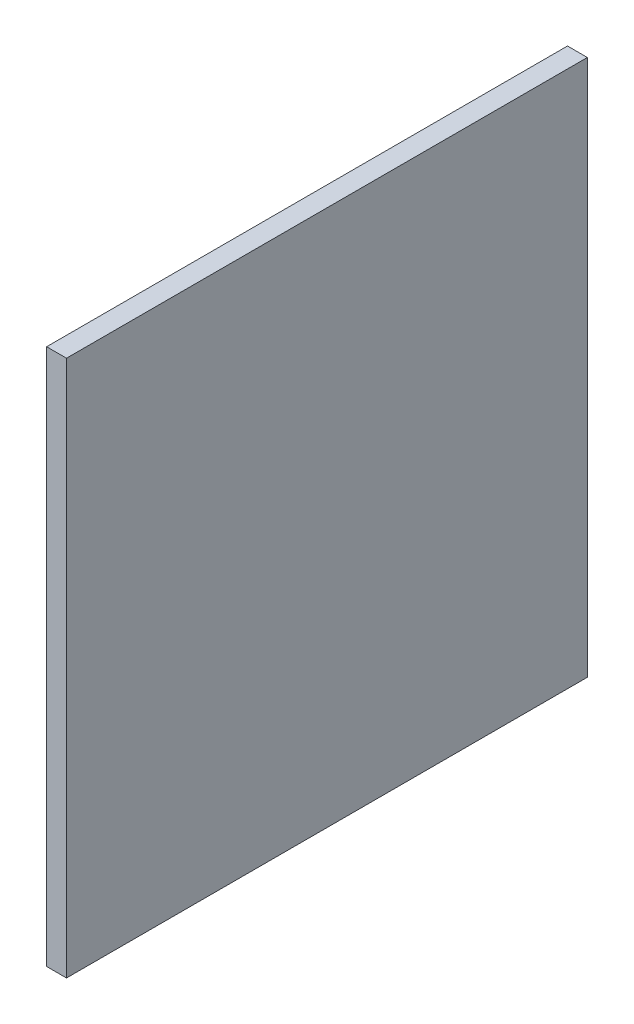
from build123d import *

# Parameters (mm, degrees)
SKETCH1_W           = 66.548
SKETCH1_H           = 68.58
BOSS_EXTRUDE1_DEPTH = 2.54
SKETCH2_W           = 0.427403846
SKETCH2_H           = 4.7625
BOSS_EXTRUDE2_DEPTH = 2.54


with BuildPart() as part:
    # Sketch1 → Boss-Extrude1 (new body)
    with BuildSketch(Plane(origin=(0, 0, 0), x_dir=(0, 0, -1), z_dir=(1, 0, 0))):
        Rectangle(SKETCH1_W, SKETCH1_H)
    extrude(amount=BOSS_EXTRUDE1_DEPTH)

    # Sketch2 → Boss-Extrude2 (add)
    # profile 1 of 15: a face of its own
    with BuildSketch(Plane.ZY):
        with Locations((-24.541075551, 0.623255141)):
            Rectangle(SKETCH2_W, SKETCH2_H)
    # profile 2 of 15: a face of its own
    with BuildSketch(Plane.ZY):
        with BuildLine():
            Line((-23.228335167, 1.722293602), (-22.800931321, 1.722293602))
            Line((-22.800931321, 1.722293602), (-22.800931321, 1.094544203))
            add(Edge.make_bspline(
                [(-22.800931321, 1.094544203), (-22.755296181, 1.151480194), (-22.666739602, 1.26196647), (-22.519259491, 1.407182681), (-22.363397969, 1.526851005), (-22.200109529, 1.622242239), (-22.029172505, 1.694151398), (-21.851628859, 1.746084326), (-21.666415634, 1.777224039), (-21.540461882, 1.781292888), (-21.476742619, 1.783351295)],
                knots=[0, 0, 0, 0, 1.12780773, 2.188550248, 3.19190651, 4.159438251, 5.104880172, 6.052711206, 7.014878035, 8, 8, 8, 8], degree=3))
            add(Edge.make_bspline(
                [(-21.476742619, 1.783351295), (-21.412339149, 1.780976582), (-21.286286023, 1.776328697), (-21.102755518, 1.7395667), (-20.931341722, 1.676776192), (-20.772655826, 1.590762625), (-20.629607725, 1.483801673), (-20.503979981, 1.359190477), (-20.400071419, 1.215858164), (-20.330406436, 1.082884869), (-20.284515465, 0.964926189), (-20.25562432, 0.863897575), (-20.231089306, 0.751341805), (-20.209818963, 0.627599007), (-20.195426536, 0.491802184), (-20.184075061, 0.344508003), (-20.175939766, 0.185764176), (-20.175616995, 0.075972729), (-20.175450551, 0.019356403)],
                knots=[0, 0, 0, 0, 1.235846778, 2.418850247, 3.575807741, 4.728682307, 5.871620074, 6.994088408, 8.11269785, 9.256955736, 9.865816715, 10.540099792, 11.271859618, 12.076849838, 12.949306005, 13.892391288, 14.913166135, 16, 16, 16, 16], degree=3))
            Line((-20.175450551, 0.019356403), (-20.175450551, -1.757994859))
            Line((-20.175450551, -1.757994859), (-20.602854398, -1.757994859))
            Line((-20.602854398, -1.757994859), (-20.602854398, -0.120885484))
            add(Edge.make_bspline(
                [(-20.602854398, -0.120885484), (-20.603117298, -0.073502086), (-20.603620183, 0.017134291), (-20.605206295, 0.146904283), (-20.609029639, 0.264587806), (-20.614402165, 0.369903509), (-20.622265774, 0.462750266), (-20.630460855, 0.543317174), (-20.640482484, 0.611501945), (-20.649412734, 0.652548003), (-20.653417799, 0.670956463)],
                knots=[0, 0, 0, 0, 1.430800155, 2.736877192, 3.918605307, 4.986035426, 5.920637409, 6.731861385, 7.431261377, 8, 8, 8, 8], degree=3))
            add(Edge.make_bspline(
                [(-20.653417799, 0.670956463), (-20.667876111, 0.72499204), (-20.69570389, 0.828993806), (-20.764466203, 0.970064979), (-20.85129907, 1.090077513), (-20.957295786, 1.188289409), (-21.081432493, 1.264721869), (-21.223364712, 1.317754286), (-21.381722791, 1.350923424), (-21.493103219, 1.354226057), (-21.551156681, 1.355947448)],
                knots=[0, 0, 0, 0, 1.084156227, 2.086665306, 3.027808233, 3.945421172, 4.874247719, 5.839848303, 6.874090471, 8, 8, 8, 8], degree=3))
            add(Edge.make_bspline(
                [(-21.551156681, 1.355947448), (-21.585538779, 1.355299742), (-21.653580063, 1.354017948), (-21.754476989, 1.341157432), (-21.852345239, 1.32012289), (-21.948167023, 1.291726637), (-22.040025843, 1.252725478), (-22.130872967, 1.208462299), (-22.217287529, 1.153287768), (-22.301112151, 1.091796244), (-22.379098507, 1.023652751), (-22.451663139, 0.951746471), (-22.516348802, 0.875171453), (-22.574952964, 0.795161525), (-22.625541958, 0.710617845), (-22.669701339, 0.622356057), (-22.707169552, 0.53025999), (-22.725787787, 0.466340353), (-22.735103496, 0.434357905)],
                knots=[0, 0, 0, 0, 1.023777757, 2.026029729, 3.023749952, 4.003683103, 4.997618607, 5.993177895, 7.010360494, 8.046726602, 9.087585522, 10.09234134, 11.086953743, 12.070360549, 13.043493632, 14.017870808, 15.008233677, 16, 16, 16, 16], degree=3))
            add(Edge.make_bspline(
                [(-22.735103496, 0.434357905), (-22.740464232, 0.410878504), (-22.752134274, 0.359765076), (-22.764738815, 0.275884633), (-22.776179123, 0.178852132), (-22.785754413, 0.0687808), (-22.791612855, -0.054714737), (-22.798000588, -0.191107073), (-22.800326132, -0.34094007), (-22.800723942, -0.44525473), (-22.800931321, -0.499633982)],
                knots=[0, 0, 0, 0, 0.615963638, 1.340920617, 2.168419149, 3.115676021, 4.16674242, 5.331190069, 6.6087489, 8, 8, 8, 8], degree=3))
            Line((-22.800931321, -0.499633982), (-22.800931321, -1.757994859))
            Line((-22.800931321, -1.757994859), (-23.228335167, -1.757994859))
            Line((-23.228335167, -1.757994859), (-23.228335167, 1.722293602))
        make_face()
    # profile 3 of 15: a face of its own
    with BuildSketch(Plane.ZY):
        with BuildLine():
            Line((-17.549969782, 1.288211571), (-17.839993821, 0.989601295))
            add(Edge.make_bspline(
                [(-17.839993821, 0.989601295), (-17.865018041, 1.018602397), (-17.913261793, 1.074513109), (-17.989776773, 1.14926676), (-18.066008891, 1.212045952), (-18.140914598, 1.265048847), (-18.216377457, 1.305120722), (-18.291511906, 1.334369088), (-18.366395739, 1.352469045), (-18.416451023, 1.354801906), (-18.441030479, 1.355947448)],
                knots=[0, 0, 0, 0, 1.26578478, 2.440284043, 3.530471711, 4.527705817, 5.468200915, 6.346673037, 7.188140097, 8, 8, 8, 8], degree=3))
            add(Edge.make_bspline(
                [(-18.441030479, 1.355947448), (-18.471155863, 1.354484853), (-18.530438356, 1.351606673), (-18.615382058, 1.322877327), (-18.694236302, 1.278778294), (-18.762485621, 1.216228185), (-18.820299214, 1.144431091), (-18.862499973, 1.064153949), (-18.888307258, 0.97781929), (-18.891579411, 0.917907233), (-18.893239013, 0.887520465)],
                knots=[0, 0, 0, 0, 0.99966794, 1.967205029, 2.953328237, 3.988086729, 5.028030931, 6.008226631, 6.989793394, 8, 8, 8, 8], degree=3))
            add(Edge.make_bspline(
                [(-18.893239013, 0.887520465), (-18.891727515, 0.860017648), (-18.888708779, 0.805089544), (-18.865240977, 0.724061683), (-18.8278675, 0.645062642), (-18.7929377, 0.596671687), (-18.774939734, 0.571737713)],
                knots=[0, 0, 0, 0, 0.960159726, 1.917612774, 2.927026955, 4, 4, 4, 4], degree=3))
            add(Edge.make_bspline(
                [(-18.774939734, 0.571737713), (-18.764103694, 0.558423689), (-18.741040549, 0.530086468), (-18.697758249, 0.490756582), (-18.648741914, 0.447292304), (-18.589795856, 0.403835394), (-18.523459636, 0.358072225), (-18.448294753, 0.311805037), (-18.366686587, 0.261507016), (-18.308261181, 0.229605838), (-18.277891958, 0.213023771)],
                knots=[0, 0, 0, 0, 0.66740084, 1.420478572, 2.27185888, 3.217733974, 4.268547843, 5.408967954, 6.65319498, 8, 8, 8, 8], degree=3))
            add(Edge.make_bspline(
                [(-18.277891958, 0.213023771), (-18.240862055, 0.192279814), (-18.169332475, 0.152209319), (-18.067696959, 0.090011473), (-17.975458164, 0.028192285), (-17.89183456, -0.032587113), (-17.81843517, -0.094027265), (-17.753033046, -0.153773177), (-17.697259485, -0.213630058), (-17.666025749, -0.255449044), (-17.651096585, -0.275437768)],
                knots=[0, 0, 0, 0, 1.27191281, 2.456916733, 3.569705269, 4.599008579, 5.553216877, 6.436649441, 7.252746552, 8, 8, 8, 8], degree=3))
            add(Edge.make_bspline(
                [(-17.651096585, -0.275437768), (-17.62631726, -0.315804838), (-17.577001805, -0.396142799), (-17.525215378, -0.528429302), (-17.495197647, -0.668733235), (-17.49103084, -0.764707435), (-17.48891209, -0.813508681)],
                knots=[0, 0, 0, 0, 0.995354457, 1.980940102, 2.973342416, 4, 4, 4, 4], degree=3))
            add(Edge.make_bspline(
                [(-17.48891209, -0.813508681), (-17.48989117, -0.84789277), (-17.491820554, -0.915650372), (-17.505234566, -1.015438122), (-17.528305445, -1.110871217), (-17.559729446, -1.202985158), (-17.602162467, -1.290015), (-17.651893577, -1.374156468), (-17.711594796, -1.453589431), (-17.779754847, -1.528209587), (-17.854383894, -1.596361979), (-17.933994032, -1.656266002), (-18.018683298, -1.706033225), (-18.107846553, -1.747215713), (-18.201686382, -1.779965735), (-18.300217458, -1.80263868), (-18.403126585, -1.816208758), (-18.473107859, -1.818092635), (-18.508766357, -1.819052552)],
                knots=[0, 0, 0, 0, 1.032770009, 2.035186124, 3.017557409, 3.978232242, 4.952395191, 5.920591857, 6.910227898, 7.931268572, 8.952309245, 9.941945286, 10.918353717, 11.897095711, 12.887975737, 13.898235213, 14.929059601, 16, 16, 16, 16], degree=3))
            add(Edge.make_bspline(
                [(-18.508766357, -1.819052552), (-18.556890978, -1.81770177), (-18.652471532, -1.815018976), (-18.793835757, -1.789837514), (-18.931976503, -1.75065521), (-19.065848392, -1.696613171), (-19.192457568, -1.62837238), (-19.308296434, -1.546644623), (-19.413767388, -1.454129662), (-19.473799753, -1.38321888), (-19.503815936, -1.347763489)],
                knots=[0, 0, 0, 0, 1.013940152, 2.01379169, 3.017749504, 4.037548394, 5.051665909, 6.043208538, 7.021604269, 8, 8, 8, 8], degree=3))
            Line((-19.503815936, -1.347763489), (-19.220470083, -1.025302552))
            add(Edge.make_bspline(
                [(-19.220470083, -1.025302552), (-19.193565478, -1.054360285), (-19.141406833, -1.110693094), (-19.057993392, -1.185701572), (-18.97311285, -1.248568302), (-18.887612794, -1.301150948), (-18.800227594, -1.341666765), (-18.711446955, -1.370130994), (-18.621451456, -1.388424699), (-18.561005622, -1.39057229), (-18.530708965, -1.391648705)],
                knots=[0, 0, 0, 0, 1.179806542, 2.287233372, 3.337373186, 4.324005949, 5.273901747, 6.200048787, 7.097828587, 8, 8, 8, 8], degree=3))
            add(Edge.make_bspline(
                [(-18.530708965, -1.391648705), (-18.48945493, -1.389783404), (-18.408851466, -1.386138919), (-18.293403351, -1.353050305), (-18.186806863, -1.301166335), (-18.094246525, -1.227572513), (-18.015458228, -1.141907966), (-17.958405962, -1.045414111), (-17.922651594, -0.940922879), (-17.918452432, -0.868488924), (-17.916315936, -0.831635184)],
                knots=[0, 0, 0, 0, 1.072336372, 2.095165389, 3.102688358, 4.141489647, 5.156069229, 6.117746104, 7.042326257, 8, 8, 8, 8], degree=3))
            add(Edge.make_bspline(
                [(-17.916315936, -0.831635184), (-17.917794072, -0.801278167), (-17.920712454, -0.741342301), (-17.943631335, -0.654596301), (-17.979843823, -0.572314887), (-18.015500863, -0.524159688), (-18.033661188, -0.499633982)],
                knots=[0, 0, 0, 0, 1.013901739, 2.00181326, 2.98231254, 4, 4, 4, 4], degree=3))
            add(Edge.make_bspline(
                [(-18.033661188, -0.499633982), (-18.044577375, -0.487339435), (-18.068356772, -0.460557473), (-18.111974797, -0.421879062), (-18.164201545, -0.380189363), (-18.22562441, -0.336195308), (-18.296367213, -0.290477206), (-18.376716678, -0.243274909), (-18.465572073, -0.192346468), (-18.52839711, -0.158574008), (-18.561237811, -0.14092004)],
                knots=[0, 0, 0, 0, 0.615000592, 1.339693406, 2.178160186, 3.116406724, 4.166410947, 5.330106347, 6.604359322, 8, 8, 8, 8], degree=3))
            add(Edge.make_bspline(
                [(-18.561237811, -0.14092004), (-18.596679846, -0.121136435), (-18.665413263, -0.082769713), (-18.762768684, -0.023012475), (-18.850599191, 0.037766923), (-18.931018187, 0.096159037), (-19.001994413, 0.155242535), (-19.063248257, 0.21508301), (-19.117191347, 0.273267134), (-19.147055504, 0.314493098), (-19.161320443, 0.334185129)],
                knots=[0, 0, 0, 0, 1.262093308, 2.447601706, 3.550203992, 4.582594899, 5.537233252, 6.418365656, 7.244515135, 8, 8, 8, 8], degree=3))
            add(Edge.make_bspline(
                [(-19.161320443, 0.334185129), (-19.185991009, 0.373843983), (-19.235340762, 0.453175552), (-19.283258576, 0.585587308), (-19.316196065, 0.724985761), (-19.319138461, 0.821170373), (-19.320642859, 0.870347989)],
                knots=[0, 0, 0, 0, 0.985009483, 1.970363186, 2.962279964, 4, 4, 4, 4], degree=3))
            add(Edge.make_bspline(
                [(-19.320642859, 0.870347989), (-19.319915972, 0.902495406), (-19.318493351, 0.965412454), (-19.30713948, 1.057857778), (-19.286467902, 1.145689373), (-19.260539597, 1.230226283), (-19.224503794, 1.309830918), (-19.181442759, 1.385564834), (-19.130841299, 1.457323351), (-19.072543821, 1.524002613), (-19.008445136, 1.584567089), (-18.939191895, 1.637360936), (-18.866341625, 1.682409226), (-18.789585882, 1.720189677), (-18.70818731, 1.748766558), (-18.622714877, 1.768438929), (-18.533341592, 1.781576901), (-18.472243988, 1.782751312), (-18.441030479, 1.783351295)],
                knots=[0, 0, 0, 0, 1.087655834, 2.128696564, 3.144119009, 4.137814668, 5.115653402, 6.093965665, 7.082169637, 8.081268856, 9.086088321, 10.061021666, 11.022561449, 11.980240094, 12.950172527, 13.934149372, 14.944599409, 16, 16, 16, 16], degree=3))
            add(Edge.make_bspline(
                [(-18.441030479, 1.783351295), (-18.40402985, 1.781848602), (-18.329334498, 1.778815029), (-18.217273382, 1.754722643), (-18.105377299, 1.715080812), (-17.99335874, 1.660330795), (-17.882038311, 1.589482653), (-17.770436802, 1.503853856), (-17.657214447, 1.404007752), (-17.586516749, 1.327672734), (-17.549969782, 1.288211571)],
                knots=[0, 0, 0, 0, 0.845714091, 1.707292901, 2.609013841, 3.555613372, 4.552488639, 5.621697636, 6.770543573, 8, 8, 8, 8], degree=3))
        make_face()
    # profile 4 of 15: a face of its own
    with BuildSketch(Plane.ZY):
        Polygon((-16.206700551, 3.126620525), (-15.779296705, 3.126620525), (-15.779296705, 1.722293602), (-15.168719782, 1.722293602), (-15.168719782, 1.294889756), (-15.779296705, 1.294889756), (-15.779296705, -1.757994859), (-16.206700551, -1.757994859), (-16.206700551, 1.294889756), (-16.817277474, 1.294889756), (-16.817277474, 1.722293602), (-16.206700551, 1.722293602), align=None)
    # profile 5 of 15: a face of its own
    with BuildSketch(Plane.ZY):
        with BuildLine():
            Line((-14.558142859, 1.722293602), (-14.130739013, 1.722293602))
            Line((-14.130739013, 1.722293602), (-14.130739013, 1.209981403))
            add(Edge.make_bspline(
                [(-14.130739013, 1.209981403), (-14.099185738, 1.257682369), (-14.038840344, 1.348910097), (-13.938538108, 1.469563681), (-13.835799646, 1.569460584), (-13.730133124, 1.649067158), (-13.620761495, 1.708684295), (-13.510085143, 1.752353746), (-13.396362807, 1.77817645), (-13.319942474, 1.781624036), (-13.281655479, 1.783351295)],
                knots=[0, 0, 0, 0, 1.2804753, 2.448899062, 3.506932113, 4.484331642, 5.4025378, 6.288909075, 7.142734305, 8, 8, 8, 8], degree=3))
            add(Edge.make_bspline(
                [(-13.281655479, 1.783351295), (-13.251956085, 1.781731328), (-13.190847651, 1.778398142), (-13.09834277, 1.754979127), (-13.003033644, 1.717589389), (-12.941607753, 1.682428229), (-12.909585167, 1.664097989)],
                knots=[0, 0, 0, 0, 0.901110191, 1.854092781, 2.881294221, 4, 4, 4, 4], degree=3))
            Line((-12.909585167, 1.664097989), (-13.144275672, 1.29393573))
            add(Edge.make_bspline(
                [(-13.144275672, 1.29393573), (-13.164834732, 1.303107306), (-13.203859766, 1.320516714), (-13.260947943, 1.341120663), (-13.313582191, 1.353252677), (-13.347115033, 1.355090618), (-13.362747727, 1.355947448)],
                knots=[0, 0, 0, 0, 1.180555205, 2.24091978, 3.179933427, 4, 4, 4, 4], degree=3))
            add(Edge.make_bspline(
                [(-13.362747727, 1.355947448), (-13.397045529, 1.353661398), (-13.467003102, 1.348998517), (-13.569715939, 1.312342496), (-13.669384458, 1.25311708), (-13.74853947, 1.187433888), (-13.809829107, 1.124095635), (-13.853562771, 1.068784773), (-13.893680366, 1.006765278), (-13.932011987, 0.939097387), (-13.96693648, 0.864625704), (-13.999531941, 0.78409426), (-14.029003465, 0.697409781), (-14.045808619, 0.637017852), (-14.054416898, 0.606082665)],
                knots=[0, 0, 0, 0, 1.125678352, 2.296057538, 3.5422874, 4.923748041, 5.663163013, 6.437101912, 7.23742474, 8.08941207, 8.991984279, 9.93940061, 10.944477711, 12, 12, 12, 12], degree=3))
            add(Edge.make_bspline(
                [(-14.054416898, 0.606082665), (-14.060856333, 0.578491225), (-14.075119193, 0.517378283), (-14.088986964, 0.414850469), (-14.102688701, 0.293714704), (-14.112345171, 0.153633805), (-14.121296007, -0.005042414), (-14.126344368, -0.182555682), (-14.130566856, -0.379088207), (-14.130679886, -0.516485452), (-14.130739013, -0.588358441)],
                knots=[0, 0, 0, 0, 0.566838948, 1.255505196, 2.06880316, 3.007127437, 4.065329342, 5.249902469, 6.561414163, 8, 8, 8, 8], degree=3))
            Line((-14.130739013, -0.588358441), (-14.130739013, -1.757994859))
            Line((-14.130739013, -1.757994859), (-14.558142859, -1.757994859))
            Line((-14.558142859, -1.757994859), (-14.558142859, 1.722293602))
        make_face()
    # profile 6 of 15: a face of its own
    with BuildSketch(Plane.ZY):
        with BuildLine():
            Line((-12.543239013, 1.722293602), (-12.115835167, 1.722293602))
            Line((-12.115835167, 1.722293602), (-12.115835167, 0.108080862))
            add(Edge.make_bspline(
                [(-12.115835167, 0.108080862), (-12.115642075, 0.06069705), (-12.115272699, -0.029945964), (-12.112767704, -0.160377486), (-12.106875684, -0.279326655), (-12.099509015, -0.386862187), (-12.090035537, -0.482965887), (-12.07876425, -0.567302084), (-12.066166184, -0.64082717), (-12.05383442, -0.685109379), (-12.048099289, -0.705703693)],
                knots=[0, 0, 0, 0, 1.388932606, 2.656963016, 3.823490214, 4.879454478, 5.816252168, 6.653371382, 7.373723809, 8, 8, 8, 8], degree=3))
            add(Edge.make_bspline(
                [(-12.048099289, -0.705703693), (-12.038898881, -0.731588386), (-12.020689338, -0.782819634), (-11.987660062, -0.85682753), (-11.946800076, -0.925373897), (-11.902087238, -0.991101938), (-11.850516973, -1.052064642), (-11.792741764, -1.108159059), (-11.730695592, -1.161504626), (-11.638500363, -1.224621075), (-11.512417577, -1.292269435), (-11.346882934, -1.350638388), (-11.16739897, -1.385521415), (-11.043349834, -1.389568526), (-10.979589674, -1.391648705)],
                knots=[0, 0, 0, 0, 0.725840625, 1.436591201, 2.137033971, 2.831655856, 3.53531722, 4.242432219, 4.957935707, 5.694543706, 7.190802206, 8.724350549, 10.316345118, 12, 12, 12, 12], degree=3))
            add(Edge.make_bspline(
                [(-10.979589674, -1.391648705), (-10.915835437, -1.389524292), (-10.792482784, -1.385413946), (-10.614970843, -1.35169063), (-10.45270374, -1.295349318), (-10.307310124, -1.216689947), (-10.179449463, -1.120430211), (-10.072899522, -1.00747894), (-9.984987508, -0.881409595), (-9.946602546, -0.787351202), (-9.927298508, -0.740048645)],
                knots=[0, 0, 0, 0, 1.157059328, 2.238695713, 3.266970494, 4.264342957, 5.228770407, 6.160125903, 7.074715775, 8, 8, 8, 8], degree=3))
            add(Edge.make_bspline(
                [(-9.927298508, -0.740048645), (-9.921591359, -0.721044503), (-9.908974247, -0.679030986), (-9.895418333, -0.607757114), (-9.883206655, -0.522760635), (-9.872779262, -0.423485358), (-9.865342737, -0.310190718), (-9.861334037, -0.182912122), (-9.856805205, -0.042049128), (-9.856736467, 0.056558787), (-9.856700551, 0.108080862)],
                knots=[0, 0, 0, 0, 0.557542046, 1.232589297, 2.036731608, 2.971723315, 4.038036528, 5.22795436, 6.551621927, 8, 8, 8, 8], degree=3))
            Line((-9.856700551, 0.108080862), (-9.856700551, 1.722293602))
            Line((-9.856700551, 1.722293602), (-9.429296705, 1.722293602))
            Line((-9.429296705, 1.722293602), (-9.429296705, 0.027942641))
            add(Edge.make_bspline(
                [(-9.429296705, 0.027942641), (-9.429897726, -0.029625332), (-9.431063788, -0.141315073), (-9.438557709, -0.303626668), (-9.451415931, -0.454886723), (-9.470932228, -0.595175304), (-9.493881592, -0.724385306), (-9.523485664, -0.842682331), (-9.558834623, -0.949701902), (-9.598711056, -1.047321963), (-9.645821525, -1.135832201), (-9.695932578, -1.219837009), (-9.753796643, -1.297252038), (-9.81471614, -1.371930946), (-9.882481965, -1.440159239), (-9.955824273, -1.503502497), (-10.033710769, -1.562929016), (-10.117869856, -1.616121078), (-10.207072928, -1.66404087), (-10.301430105, -1.706517034), (-10.402097106, -1.740130183), (-10.507775126, -1.769127911), (-10.618981922, -1.791871527), (-10.735610285, -1.807909677), (-10.857620931, -1.817741288), (-10.940773446, -1.818608124), (-10.98340578, -1.819052552)],
                knots=[0, 0, 0, 0, 1.493040784, 2.896703357, 4.213163133, 5.428574705, 6.569057535, 7.615249723, 8.588095153, 9.490268104, 10.346124644, 11.18633936, 12.024365274, 12.850166724, 13.684164916, 14.514361689, 15.362232829, 16.222528818, 17.093394965, 17.986930858, 18.902426812, 19.842810585, 20.827885679, 21.843828298, 22.894529745, 24, 24, 24, 24], degree=3))
            add(Edge.make_bspline(
                [(-10.98340578, -1.819052552), (-11.025719251, -1.818590307), (-11.10886916, -1.817681954), (-11.230886103, -1.807963994), (-11.3478376, -1.791896448), (-11.459307856, -1.768961313), (-11.565408733, -1.74033315), (-11.666570002, -1.706310482), (-11.761607136, -1.664018826), (-11.851661934, -1.616424364), (-11.93602947, -1.562587329), (-12.015098642, -1.503575818), (-12.088763431, -1.439477925), (-12.157040084, -1.370561342), (-12.218970241, -1.295971154), (-12.275325641, -1.216307373), (-12.326973872, -1.132359346), (-12.373718204, -1.042466257), (-12.413875272, -0.943716486), (-12.449329017, -0.834455079), (-12.478326707, -0.713484155), (-12.501924852, -0.580907138), (-12.520908776, -0.437358528), (-12.534088848, -0.282007934), (-12.541458246, -0.115233767), (-12.542632626, -4.9452e-05), (-12.543239013, 0.059425513)],
                knots=[0, 0, 0, 0, 1.083640291, 2.129454052, 3.13281866, 4.105697902, 5.042300162, 5.946461698, 6.836384745, 7.703652036, 8.553297018, 9.397182691, 10.228592656, 11.052265423, 11.879314572, 12.708807002, 13.549817954, 14.402308542, 15.300838682, 16.27712199, 17.341985831, 18.484375296, 19.725102775, 21.0496083, 22.476576903, 24, 24, 24, 24], degree=3))
            Line((-12.543239013, 0.059425513), (-12.543239013, 1.722293602))
        make_face()
    # profile 7 of 15: a face of its own
    with BuildSketch(Plane.ZY):
        with BuildLine():
            Line((-8.452373628, 1.722293602), (-8.024969782, 1.722293602))
            Line((-8.024969782, 1.722293602), (-8.024969782, 1.117440838))
            add(Edge.make_bspline(
                [(-8.024969782, 1.117440838), (-7.986483407, 1.170355753), (-7.912739824, 1.271745804), (-7.791819061, 1.405354726), (-7.671020136, 1.518740536), (-7.584025071, 1.578262087), (-7.542232402, 1.606856403)],
                knots=[0, 0, 0, 0, 1.134379233, 2.173579362, 3.122582517, 4, 4, 4, 4], degree=3))
            add(Edge.make_bspline(
                [(-7.542232402, 1.606856403), (-7.485266558, 1.634077989), (-7.372330131, 1.688045569), (-7.193506114, 1.742791947), (-7.01052451, 1.776435746), (-6.886960476, 1.781036829), (-6.824804518, 1.783351295)],
                knots=[0, 0, 0, 0, 1.014936303, 2.012140481, 3.000054389, 4, 4, 4, 4], degree=3))
            add(Edge.make_bspline(
                [(-6.824804518, 1.783351295), (-6.782767976, 1.781928953), (-6.69957992, 1.779114214), (-6.576320855, 1.760798952), (-6.456770387, 1.729140338), (-6.341634868, 1.685043229), (-6.233157801, 1.631639702), (-6.133704285, 1.568979206), (-6.044408488, 1.498634257), (-5.965315539, 1.41742828), (-5.89419233, 1.32308098), (-5.828770756, 1.213047842), (-5.768320735, 1.084858131), (-5.734818169, 0.991830802), (-5.717179818, 0.942853999)],
                knots=[0, 0, 0, 0, 1.009824226, 1.998387844, 2.986035974, 3.974953746, 4.955485308, 5.885931332, 6.793869504, 7.679848016, 8.601185859, 9.625726857, 10.749998409, 12, 12, 12, 12], degree=3))
            add(Edge.make_bspline(
                [(-5.717179818, 0.942853999), (-5.698522723, 0.976496869), (-5.661808179, 1.042701314), (-5.600160151, 1.136397735), (-5.535570042, 1.224036977), (-5.467487393, 1.305688576), (-5.396152509, 1.380949316), (-5.321229675, 1.450068025), (-5.243145383, 1.51334153), (-5.134570942, 1.587259829), (-4.993311644, 1.665774651), (-4.815210317, 1.73384907), (-4.629948833, 1.775917087), (-4.504194751, 1.780856851), (-4.440692438, 1.783351295)],
                knots=[0, 0, 0, 0, 0.86119277, 1.694706429, 2.50939023, 3.298075842, 4.073795165, 4.829715201, 5.57930267, 6.321991688, 7.768977793, 9.186738141, 10.579381044, 12, 12, 12, 12], degree=3))
            add(Edge.make_bspline(
                [(-4.440692438, 1.783351295), (-4.382343019, 1.781150719), (-4.268147541, 1.776843979), (-4.10189919, 1.743025503), (-3.946856948, 1.684953419), (-3.803332784, 1.605714078), (-3.673847466, 1.506138117), (-3.561294202, 1.387662306), (-3.466356672, 1.251124666), (-3.404337166, 1.122684138), (-3.362270324, 1.00928856), (-3.336333431, 0.912669285), (-3.313419417, 0.806327351), (-3.294394937, 0.690135602), (-3.280490407, 0.563683596), (-3.270188826, 0.427178268), (-3.263216426, 0.280513527), (-3.262723749, 0.179323329), (-3.262469782, 0.127161391)],
                knots=[0, 0, 0, 0, 1.209669288, 2.367440248, 3.500751976, 4.631527125, 5.755587489, 6.87532382, 8.007944318, 9.190864318, 9.82315674, 10.514484317, 11.263564316, 12.079023757, 12.955305781, 13.901327259, 14.918167583, 16, 16, 16, 16], degree=3))
            Line((-3.262469782, 0.127161391), (-3.262469782, -1.757994859))
            Line((-3.262469782, -1.757994859), (-3.689873628, -1.757994859))
            Line((-3.689873628, -1.757994859), (-3.689873628, 0.129069444))
            add(Edge.make_bspline(
                [(-3.689873628, 0.129069444), (-3.689979605, 0.173592796), (-3.690183275, 0.259159908), (-3.693848538, 0.381967708), (-3.700754591, 0.493911437), (-3.708829938, 0.594838457), (-3.720047408, 0.68498413), (-3.734533479, 0.764167385), (-3.749879179, 0.833011107), (-3.77537351, 0.909328193), (-3.816124034, 0.993515872), (-3.878196391, 1.084307595), (-3.956396785, 1.16333897), (-4.046693998, 1.231943893), (-4.149493846, 1.287724527), (-4.262793345, 1.327560811), (-4.385889072, 1.352220871), (-4.471100795, 1.354678342), (-4.515106501, 1.355947448)],
                knots=[0, 0, 0, 0, 1.253487763, 2.409012846, 3.458416907, 4.410876679, 5.259312806, 6.014470957, 6.676830364, 7.243083969, 8.276244668, 9.299465089, 10.325150304, 11.392391894, 12.482080715, 13.603491619, 14.762376348, 16, 16, 16, 16], degree=3))
            add(Edge.make_bspline(
                [(-4.515106501, 1.355947448), (-4.569085975, 1.354020463), (-4.675769936, 1.350212007), (-4.831497544, 1.31133113), (-4.981136677, 1.252711217), (-5.120222269, 1.167758481), (-5.248167227, 1.065965671), (-5.358248438, 0.944930686), (-5.449187948, 0.808002107), (-5.510765679, 0.681256058), (-5.54966755, 0.567405851), (-5.575353639, 0.467941212), (-5.595333539, 0.354890936), (-5.614071295, 0.229014672), (-5.626301025, 0.089445962), (-5.637415846, -0.063169577), (-5.642614948, -0.229290964), (-5.643342194, -0.344443708), (-5.643719782, -0.404231338)],
                knots=[0, 0, 0, 0, 1.090531906, 2.155305635, 3.229839962, 4.33261226, 5.44038871, 6.529323825, 7.629011124, 8.757537029, 9.370236727, 10.061839251, 10.834451254, 11.692844982, 12.636905849, 13.66920014, 14.789842145, 16, 16, 16, 16], degree=3))
            Line((-5.643719782, -0.404231338), (-5.643719782, -1.757994859))
            Line((-5.643719782, -1.757994859), (-6.071123628, -1.757994859))
            Line((-6.071123628, -1.757994859), (-6.071123628, 0.011724191))
            add(Edge.make_bspline(
                [(-6.071123628, 0.011724191), (-6.071231711, 0.061653314), (-6.071439652, 0.157711929), (-6.075081355, 0.295462037), (-6.082002794, 0.420758078), (-6.09000454, 0.533454427), (-6.101516426, 0.633346271), (-6.114592566, 0.720969138), (-6.130034783, 0.79610336), (-6.155602447, 0.878512823), (-6.194674634, 0.969300936), (-6.257523662, 1.06610354), (-6.33591112, 1.150832629), (-6.427855776, 1.223166498), (-6.531277794, 1.282958299), (-6.645555207, 1.326038176), (-6.769659035, 1.35110837), (-6.855217627, 1.354304003), (-6.89921858, 1.355947448)],
                knots=[0, 0, 0, 0, 1.320475261, 2.540461679, 3.643808994, 4.639130445, 5.527981419, 6.302341397, 6.981980563, 7.553956391, 8.582137848, 9.585246428, 10.591171744, 11.620968678, 12.668337649, 13.738356861, 14.836885341, 16, 16, 16, 16], degree=3))
            add(Edge.make_bspline(
                [(-6.89921858, 1.355947448), (-6.950947782, 1.35386493), (-7.054042245, 1.349714544), (-7.205492425, 1.312357121), (-7.35174973, 1.253840862), (-7.490480945, 1.172660894), (-7.617944697, 1.072105362), (-7.729534518, 0.953839022), (-7.823345597, 0.81933373), (-7.885573531, 0.693924155), (-7.925712526, 0.582926235), (-7.952376178, 0.48855941), (-7.975290098, 0.383784072), (-7.992318106, 0.268276967), (-8.0087561, 0.142790407), (-8.016689485, 0.006699262), (-8.02440686, -0.139879722), (-8.024777539, -0.241079506), (-8.024969782, -0.29356427)],
                knots=[0, 0, 0, 0, 1.098833095, 2.189935336, 3.297829714, 4.440610912, 5.596351641, 6.740013378, 7.886572111, 9.072425424, 9.705826452, 10.395263256, 11.156850408, 11.985370555, 12.878090359, 13.847760091, 14.883794034, 16, 16, 16, 16], degree=3))
            Line((-8.024969782, -0.29356427), (-8.024969782, -1.757994859))
            Line((-8.024969782, -1.757994859), (-8.452373628, -1.757994859))
            Line((-8.452373628, -1.757994859), (-8.452373628, 1.722293602))
        make_face()
    # profile 8 of 15: a face of its own
    with BuildSketch(Plane.ZY):
        with BuildLine():
            Line((0.570808463, -0.658956398), (0.950510987, -0.858347924))
            add(Edge.make_bspline(
                [(0.950510987, -0.858347924), (0.920253334, -0.912019028), (0.861383924, -1.016441743), (0.760145764, -1.159904382), (0.654020836, -1.288965024), (0.538218651, -1.400175732), (0.416203838, -1.49712851), (0.287299761, -1.581952478), (0.150835334, -1.654231608), (0.006804102, -1.715127012), (-0.146003502, -1.761948502), (-0.307957779, -1.795019602), (-0.479368993, -1.815461979), (-0.596861473, -1.817836617), (-0.657023568, -1.819052552)],
                knots=[0, 0, 0, 0, 1.120438281, 2.179929193, 3.190490725, 4.156257408, 5.095198341, 6.022838206, 6.959905092, 7.901321166, 8.864066838, 9.862729781, 10.905609505, 12, 12, 12, 12], degree=3))
            add(Edge.make_bspline(
                [(-0.657023568, -1.819052552), (-0.723891759, -1.817491574), (-0.854332228, -1.814446558), (-1.044205955, -1.788195026), (-1.222975806, -1.745370138), (-1.390631731, -1.685545598), (-1.546763154, -1.607403417), (-1.691680388, -1.512208551), (-1.826145529, -1.400450019), (-1.945921328, -1.271159787), (-2.053749611, -1.132799695), (-2.148898673, -0.988624009), (-2.228442535, -0.838995479), (-2.293148051, -0.684866659), (-2.345406099, -0.527209003), (-2.381827935, -0.364588042), (-2.402823414, -0.197443908), (-2.406040749, -0.084372176), (-2.40766209, -0.027390893)],
                knots=[0, 0, 0, 0, 1.145258523, 2.234067595, 3.276747158, 4.290159414, 5.277019952, 6.260822364, 7.254936242, 8.264827045, 9.274100331, 10.257902744, 11.220704747, 12.172965371, 13.118907548, 14.062713208, 15.023725156, 16, 16, 16, 16], degree=3))
            add(Edge.make_bspline(
                [(-2.40766209, -0.027390893), (-2.406220901, 0.026078144), (-2.403364655, 0.132046715), (-2.385361334, 0.288890188), (-2.353454907, 0.441328904), (-2.309672123, 0.589489527), (-2.253132749, 0.733123988), (-2.183964622, 0.872319703), (-2.102059993, 1.006928554), (-2.038823962, 1.09184139), (-2.006970984, 1.134613314)],
                knots=[0, 0, 0, 0, 1.024358464, 2.0301432, 3.019427413, 4.004406732, 4.986367066, 5.972626655, 6.978780325, 8, 8, 8, 8], degree=3))
            add(Edge.make_bspline(
                [(-2.006970984, 1.134613314), (-1.963825887, 1.186142026), (-1.878902421, 1.287567153), (-1.73527038, 1.420833232), (-1.57974047, 1.532471368), (-1.414261793, 1.62500965), (-1.236911091, 1.69532272), (-1.050072377, 1.747720537), (-0.851618204, 1.777082045), (-0.715947886, 1.781229276), (-0.646529277, 1.783351295)],
                knots=[0, 0, 0, 0, 1.030682036, 2.02871468, 2.997146059, 3.962720338, 4.930598197, 5.918074684, 6.934738563, 8, 8, 8, 8], degree=3))
            add(Edge.make_bspline(
                [(-0.646529277, 1.783351295), (-0.575163072, 1.781508821), (-0.435158844, 1.777894308), (-0.231007994, 1.744384904), (-0.037840019, 1.691245535), (0.144267782, 1.616196984), (0.315333871, 1.519369166), (0.474246317, 1.399433303), (0.623722839, 1.260071548), (0.710684156, 1.152897324), (0.754935566, 1.098360309)],
                knots=[0, 0, 0, 0, 1.056321875, 2.072262726, 3.055038591, 4.01806755, 4.982017516, 5.957941055, 6.960871419, 8, 8, 8, 8], degree=3))
            add(Edge.make_bspline(
                [(0.754935566, 1.098360309), (0.785044007, 1.057261864), (0.845060479, 0.975338539), (0.920235997, 0.841755643), (0.98549231, 0.70199587), (1.037652517, 0.553800073), (1.07988841, 0.398924144), (1.110445724, 0.236260895), (1.128365812, 0.065858766), (1.13188829, -0.050246297), (1.133684064, -0.109437167)],
                knots=[0, 0, 0, 0, 0.94817472, 1.890038105, 2.849395472, 3.817997239, 4.812318967, 5.836947057, 6.897266129, 8, 8, 8, 8], degree=3))
            Line((1.133684064, -0.109437167), (-1.980258244, -0.109437167))
            add(Edge.make_bspline(
                [(-1.980258244, -0.109437167), (-1.978163279, -0.15529387), (-1.974043616, -0.245469227), (-1.954836939, -0.377418757), (-1.924562715, -0.503112483), (-1.882014455, -0.621607623), (-1.830488497, -0.734451832), (-1.76737079, -0.840808032), (-1.692069468, -0.940191787), (-1.608078427, -1.033492071), (-1.514587701, -1.116578321), (-1.416231534, -1.190943773), (-1.311601362, -1.253272103), (-1.201522184, -1.30386331), (-1.086172005, -1.34346869), (-0.965514482, -1.370503118), (-0.839787045, -1.388610288), (-0.754081457, -1.39062369), (-0.710449049, -1.391648705)],
                knots=[0, 0, 0, 0, 1.094153842, 2.151609401, 3.174256925, 4.172055639, 5.149267565, 6.128595816, 7.11444997, 8.118368179, 9.117203808, 10.09244225, 11.054858984, 12.015122123, 12.976791628, 13.957293641, 14.960065497, 16, 16, 16, 16], degree=3))
            add(Edge.make_bspline(
                [(-0.710449049, -1.391648705), (-0.667789095, -1.390821314), (-0.583143562, -1.389179611), (-0.457085824, -1.373215832), (-0.333070967, -1.347402707), (-0.211612272, -1.312173828), (-0.095174799, -1.269206754), (0.012655753, -1.217359651), (0.111824904, -1.160005889), (0.204512633, -1.094406295), (0.294416378, -1.014113012), (0.383600975, -0.913915835), (0.479227421, -0.795414591), (0.539084689, -0.706225667), (0.570808463, -0.658956398)],
                knots=[0, 0, 0, 0, 0.99110716, 1.966546729, 2.947904876, 3.932708344, 4.903319531, 5.828989031, 6.710028674, 7.56322171, 8.463672341, 9.504779593, 10.677557249, 12, 12, 12, 12], degree=3))
        make_face()
        with BuildLine():
            add(Edge.make_bspline(
                [(0.706280218, 0.317966679), (0.690636597, 0.374657947), (0.660527661, 0.483770388), (0.59761318, 0.634865313), (0.52675869, 0.76915135), (0.44290912, 0.885600779), (0.347905783, 0.989019845), (0.238170731, 1.079396563), (0.115113319, 1.160246738), (-0.020630369, 1.22848996), (-0.164378655, 1.286578661), (-0.314882081, 1.325529265), (-0.468449285, 1.352212249), (-0.572318439, 1.354697061), (-0.624586669, 1.355947448)],
                knots=[0, 0, 0, 0, 1.154881502, 2.222775134, 3.210006277, 4.132804581, 5.035138423, 5.962687519, 6.919655026, 7.923214229, 8.944639381, 9.960483929, 10.97369054, 12, 12, 12, 12], degree=3))
            add(Edge.make_bspline(
                [(-0.624586669, 1.355947448), (-0.667244298, 1.355115138), (-0.751569462, 1.353469836), (-0.87580413, 1.337862267), (-0.995111149, 1.312063335), (-1.110370844, 1.276732448), (-1.220072811, 1.229640028), (-1.326473549, 1.174417852), (-1.426867588, 1.107005911), (-1.489652708, 1.055626898), (-1.521371525, 1.029670405)],
                knots=[0, 0, 0, 0, 1.04873581, 2.073130211, 3.073294108, 4.04793562, 5.032784715, 6.005352987, 6.992311501, 8, 8, 8, 8], degree=3))
            add(Edge.make_bspline(
                [(-1.521371525, 1.029670405), (-1.544086312, 1.009131354), (-1.590055506, 0.967565321), (-1.651478858, 0.895952008), (-1.710289573, 0.818729346), (-1.763811436, 0.732942945), (-1.812902723, 0.63956967), (-1.858840406, 0.539397103), (-1.900187631, 0.431665093), (-1.923450553, 0.356591167), (-1.935419001, 0.317966679)],
                knots=[0, 0, 0, 0, 0.879870761, 1.780643979, 2.707998968, 3.669668524, 4.684282772, 5.740141944, 6.837334558, 8, 8, 8, 8], degree=3))
            Line((-1.935419001, 0.317966679), (0.706280218, 0.317966679))
        make_face(mode=Mode.SUBTRACT)
    # profile 9 of 15: a face of its own
    with BuildSketch(Plane.ZY):
        with BuildLine():
            Line((1.988491756, 1.722293602), (2.415895602, 1.722293602))
            Line((2.415895602, 1.722293602), (2.415895602, 1.094544203))
            add(Edge.make_bspline(
                [(2.415895602, 1.094544203), (2.461530742, 1.151480194), (2.550087322, 1.26196647), (2.697567432, 1.407182681), (2.853428954, 1.526851005), (3.016717394, 1.622242239), (3.187654419, 1.694151398), (3.365198064, 1.746084326), (3.55041129, 1.777224039), (3.676365041, 1.781292888), (3.740084304, 1.783351295)],
                knots=[0, 0, 0, 0, 1.12780773, 2.188550248, 3.19190651, 4.159438251, 5.104880172, 6.052711206, 7.014878035, 8, 8, 8, 8], degree=3))
            add(Edge.make_bspline(
                [(3.740084304, 1.783351295), (3.804487774, 1.780976582), (3.9305409, 1.776328697), (4.114071405, 1.7395667), (4.285485202, 1.676776192), (4.444171097, 1.590762625), (4.587219198, 1.483801673), (4.712846942, 1.359190477), (4.816755504, 1.215858164), (4.886420487, 1.082884869), (4.932311458, 0.964926189), (4.961202603, 0.863897575), (4.985737617, 0.751341805), (5.00700796, 0.627599007), (5.021400387, 0.491802184), (5.032751862, 0.344508003), (5.040887157, 0.185764176), (5.041209928, 0.075972729), (5.041376372, 0.019356403)],
                knots=[0, 0, 0, 0, 1.235846778, 2.418850247, 3.575807741, 4.728682307, 5.871620074, 6.994088408, 8.11269785, 9.256955736, 9.865816715, 10.540099792, 11.271859618, 12.076849838, 12.949306005, 13.892391288, 14.913166135, 16, 16, 16, 16], degree=3))
            Line((5.041376372, 0.019356403), (5.041376372, -1.757994859))
            Line((5.041376372, -1.757994859), (4.613972526, -1.757994859))
            Line((4.613972526, -1.757994859), (4.613972526, -0.120885484))
            add(Edge.make_bspline(
                [(4.613972526, -0.120885484), (4.613709625, -0.073502086), (4.61320674, 0.017134291), (4.611620628, 0.146904283), (4.607797284, 0.264587806), (4.602424758, 0.369903509), (4.594561149, 0.462750266), (4.586366068, 0.543317174), (4.576344439, 0.611501945), (4.567414189, 0.652548003), (4.563409124, 0.670956463)],
                knots=[0, 0, 0, 0, 1.430800155, 2.736877192, 3.918605307, 4.986035426, 5.920637409, 6.731861385, 7.431261377, 8, 8, 8, 8], degree=3))
            add(Edge.make_bspline(
                [(4.563409124, 0.670956463), (4.548950812, 0.72499204), (4.521123033, 0.828993806), (4.452360721, 0.970064979), (4.365527853, 1.090077513), (4.259531137, 1.188289409), (4.13539443, 1.264721869), (3.993462211, 1.317754286), (3.835104132, 1.350923424), (3.723723704, 1.354226057), (3.665670242, 1.355947448)],
                knots=[0, 0, 0, 0, 1.084156227, 2.086665306, 3.027808233, 3.945421172, 4.874247719, 5.839848303, 6.874090471, 8, 8, 8, 8], degree=3))
            add(Edge.make_bspline(
                [(3.665670242, 1.355947448), (3.631288144, 1.355299742), (3.56324686, 1.354017948), (3.462349934, 1.341157432), (3.364481684, 1.32012289), (3.2686599, 1.291726637), (3.17680108, 1.252725478), (3.085953956, 1.208462299), (2.999539394, 1.153287768), (2.915714772, 1.091796244), (2.837728416, 1.023652751), (2.765163784, 0.951746471), (2.700478121, 0.875171453), (2.641873959, 0.795161525), (2.591284965, 0.710617845), (2.547125584, 0.622356057), (2.509657371, 0.53025999), (2.491039136, 0.466340353), (2.481723427, 0.434357905)],
                knots=[0, 0, 0, 0, 1.023777757, 2.026029729, 3.023749952, 4.003683103, 4.997618607, 5.993177895, 7.010360494, 8.046726602, 9.087585522, 10.09234134, 11.086953743, 12.070360549, 13.043493632, 14.017870808, 15.008233677, 16, 16, 16, 16], degree=3))
            add(Edge.make_bspline(
                [(2.481723427, 0.434357905), (2.476362691, 0.410878504), (2.464692649, 0.359765076), (2.452088108, 0.275884633), (2.4406478, 0.178852132), (2.43107251, 0.0687808), (2.425214068, -0.054714737), (2.418826335, -0.191107073), (2.416500791, -0.34094007), (2.416102981, -0.44525473), (2.415895602, -0.499633982)],
                knots=[0, 0, 0, 0, 0.615963638, 1.340920617, 2.168419149, 3.115676021, 4.16674242, 5.331190069, 6.6087489, 8, 8, 8, 8], degree=3))
            Line((2.415895602, -0.499633982), (2.415895602, -1.757994859))
            Line((2.415895602, -1.757994859), (1.988491756, -1.757994859))
            Line((1.988491756, -1.757994859), (1.988491756, 1.722293602))
        make_face()
    # profile 10 of 15: a face of its own
    with BuildSketch(Plane.ZY):
        Polygon((6.445703295, 3.126620525), (6.873107141, 3.126620525), (6.873107141, 1.722293602), (7.483684064, 1.722293602), (7.483684064, 1.294889756), (6.873107141, 1.294889756), (6.873107141, -1.757994859), (6.445703295, -1.757994859), (6.445703295, 1.294889756), (5.835126372, 1.294889756), (5.835126372, 1.722293602), (6.445703295, 1.722293602), align=None)
    # profile 11 of 15: a face of its own
    with BuildSketch(Plane.ZY):
        with BuildLine():
            Line((10.170222526, 3.004505141), (11.09944428, 3.004505141))
            add(Edge.make_bspline(
                [(11.09944428, 3.004505141), (11.144930888, 3.004265995), (11.233095255, 3.00380247), (11.361300995, 2.996613638), (11.481382413, 2.986811502), (11.593374331, 2.971258411), (11.697225001, 2.952491743), (11.793247394, 2.929765343), (11.881136164, 2.902514844), (11.986064566, 2.859181154), (12.105699465, 2.794787843), (12.235237278, 2.699635045), (12.346005189, 2.583249801), (12.441508714, 2.451964473), (12.517438094, 2.307544012), (12.572369174, 2.153430616), (12.60714614, 1.991612103), (12.610722688, 1.880519065), (12.612530218, 1.824374432)],
                knots=[0, 0, 0, 0, 1.001505555, 1.941167018, 2.826882275, 3.653841531, 4.429895133, 5.150066043, 5.825578002, 6.45369114, 7.647487171, 8.808567382, 9.977351308, 11.170798116, 12.373658725, 13.556498008, 14.765093433, 16, 16, 16, 16], degree=3))
            add(Edge.make_bspline(
                [(12.612530218, 1.824374432), (12.61104266, 1.771779347), (12.608119468, 1.668425046), (12.580166642, 1.517257704), (12.536405161, 1.37336051), (12.47557409, 1.237258621), (12.396513874, 1.112027169), (12.302817376, 0.996655925), (12.189773584, 0.896029665), (12.105078318, 0.839773787), (12.062056961, 0.81119835)],
                knots=[0, 0, 0, 0, 1.044552857, 2.05264487, 3.044412934, 4.028983338, 5.005914585, 5.980388656, 6.974128949, 8, 8, 8, 8], degree=3))
            add(Edge.make_bspline(
                [(12.062056961, 0.81119835), (12.116159542, 0.790427048), (12.219671184, 0.750686401), (12.362118936, 0.680425288), (12.48484835, 0.604004702), (12.588803038, 0.520549577), (12.677708919, 0.430594374), (12.755341671, 0.332820094), (12.821583113, 0.225951284), (12.878342484, 0.111102187), (12.922632041, -0.010554471), (12.955800682, -0.137877563), (12.97480639, -0.270410529), (12.977511002, -0.360605992), (12.978876372, -0.40613939)],
                knots=[0, 0, 0, 0, 1.27268992, 2.434971085, 3.483601985, 4.442670788, 5.356604649, 6.2567628, 7.179492994, 8.113709626, 9.066344395, 10.018646069, 10.999752585, 12, 12, 12, 12], degree=3))
            add(Edge.make_bspline(
                [(12.978876372, -0.40613939), (12.977547163, -0.452630741), (12.974931909, -0.544103777), (12.955637019, -0.678481299), (12.922967484, -0.806898637), (12.877967102, -0.930186404), (12.819235524, -1.048106087), (12.747759973, -1.160791278), (12.662536309, -1.267109778), (12.567200763, -1.368242994), (12.459347629, -1.459176519), (12.34298512, -1.540160391), (12.216647806, -1.606761997), (12.082410628, -1.662709155), (11.938767755, -1.705445379), (11.786364207, -1.735343774), (11.625331425, -1.755489199), (11.514828157, -1.757145467), (11.458158223, -1.757994859)],
                knots=[0, 0, 0, 0, 0.978564426, 1.925352924, 2.850884081, 3.763762016, 4.682927383, 5.618979971, 6.567305752, 7.547517671, 8.540179244, 9.531824382, 10.526200242, 11.540722885, 12.589160233, 13.674978461, 14.80764778, 16, 16, 16, 16], degree=3))
            Line((11.458158223, -1.757994859), (10.170222526, -1.757994859))
            Line((10.170222526, -1.757994859), (10.170222526, 3.004505141))
        make_face()
        with BuildLine():
            Line((10.597626372, 2.516043602), (10.597626372, 0.989601295))
            Line((10.597626372, 0.989601295), (10.884788331, 0.989601295))
            add(Edge.make_bspline(
                [(10.884788331, 0.989601295), (10.926764727, 0.990145476), (11.00787168, 0.991196944), (11.125328396, 0.994208908), (11.234355653, 1.002642675), (11.334765255, 1.011074017), (11.42639908, 1.024782652), (11.50905412, 1.041100505), (11.584027568, 1.058358315), (11.670486735, 1.087708224), (11.768557426, 1.131084632), (11.873105328, 1.198401666), (11.965272589, 1.278580876), (12.043101619, 1.371097149), (12.106798656, 1.472968637), (12.151040533, 1.582569928), (12.181040587, 1.697169465), (12.183750492, 1.775843587), (12.185126372, 1.815788194)],
                knots=[0, 0, 0, 0, 1.156816544, 2.235205308, 3.236616184, 4.169592532, 5.011045266, 5.787822928, 6.49130361, 7.128639758, 8.301311294, 9.436451833, 10.541879658, 11.654887649, 12.756523258, 13.837046038, 14.901820046, 16, 16, 16, 16], degree=3))
            add(Edge.make_bspline(
                [(12.185126372, 1.815788194), (12.184410391, 1.842221118), (12.183005916, 1.894072187), (12.171503386, 1.969658987), (12.151953223, 2.040747807), (12.126842202, 2.108312864), (12.091751165, 2.170241489), (12.050435167, 2.228674909), (12.000516424, 2.281623184), (11.943696652, 2.33111168), (11.878370633, 2.37498727), (11.80457734, 2.41341488), (11.721318393, 2.44435858), (11.629996973, 2.471458773), (11.529207386, 2.490492844), (11.420112726, 2.506349775), (11.301819412, 2.514422542), (11.219979111, 2.515491196), (11.177674449, 2.516043602)],
                knots=[0, 0, 0, 0, 0.91205012, 1.789085906, 2.630437955, 3.453916878, 4.269457761, 5.079663411, 5.91843418, 6.774407191, 7.675494373, 8.627863946, 9.638891023, 10.736472738, 11.911756761, 13.175263542, 14.539845004, 16, 16, 16, 16], degree=3))
            Line((11.177674449, 2.516043602), (10.597626372, 2.516043602))
        make_face(mode=Mode.SUBTRACT)
        with BuildLine():
            Line((10.597626372, 0.501139756), (10.597626372, -1.269533321))
            Line((10.597626372, -1.269533321), (11.206295242, -1.269533321))
            add(Edge.make_bspline(
                [(11.206295242, -1.269533321), (11.249863852, -1.26901115), (11.333836604, -1.268004735), (11.45507792, -1.264719216), (11.567449929, -1.257245798), (11.670439857, -1.245481267), (11.765159794, -1.232719877), (11.850473455, -1.215559527), (11.927072407, -1.19589862), (12.01589209, -1.165508193), (12.115909364, -1.11829621), (12.223692708, -1.047111494), (12.319522669, -0.962307279), (12.400900539, -0.864157714), (12.467593213, -0.757435087), (12.5161101, -0.644298021), (12.546033373, -0.526615929), (12.549655825, -0.44637908), (12.551472526, -0.40613939)],
                knots=[0, 0, 0, 0, 1.160039823, 2.235823828, 3.228722157, 4.157150951, 4.99529583, 5.772374946, 6.472645482, 7.099169577, 8.269452708, 9.405989375, 10.527446681, 11.663510218, 12.788923519, 13.866172445, 14.929861265, 16, 16, 16, 16], degree=3))
            add(Edge.make_bspline(
                [(12.551472526, -0.40613939), (12.551096826, -0.380975238), (12.550351488, -0.331052833), (12.539111152, -0.257688807), (12.522763707, -0.186624315), (12.501629863, -0.11766639), (12.470851231, -0.05206176), (12.434919468, 0.01148708), (12.392789847, 0.073064136), (12.327143321, 0.150913667), (12.231659299, 0.240607888), (12.095986866, 0.328424989), (11.94171956, 0.399247184), (11.829831436, 0.429318257), (11.772032922, 0.444852196)],
                knots=[0, 0, 0, 0, 0.723448775, 1.435228256, 2.130040452, 2.821711965, 3.505591119, 4.210454504, 4.921174351, 5.648778258, 7.137944449, 8.670945889, 10.280296675, 12, 12, 12, 12], degree=3))
            add(Edge.make_bspline(
                [(11.772032922, 0.444852196), (11.748861188, 0.449553578), (11.698620089, 0.459747144), (11.616694775, 0.470507269), (11.523164896, 0.480093583), (11.417814481, 0.48718448), (11.30051024, 0.494514026), (11.171001647, 0.497364479), (11.029817586, 0.500765258), (10.931856537, 0.50101173), (10.880972225, 0.501139756)],
                knots=[0, 0, 0, 0, 0.634451884, 1.375622551, 2.216452059, 3.157844607, 4.20941857, 5.370758133, 6.634282058, 8, 8, 8, 8], degree=3))
            Line((10.880972225, 0.501139756), (10.597626372, 0.501139756))
        make_face(mode=Mode.SUBTRACT)
    # profile 12 of 15: a face of its own
    with BuildSketch(Plane.ZY):
        with BuildLine():
            add(Edge.make_bspline(
                [(15.514678655, 1.783351295), (15.579981066, 1.781960793), (15.708023134, 1.779234358), (15.895540293, 1.750094709), (16.074535639, 1.705534902), (16.245694707, 1.643933241), (16.406825452, 1.561362444), (16.560274895, 1.462834087), (16.705622325, 1.346108487), (16.792739375, 1.255814115), (16.836959304, 1.209981403)],
                knots=[0, 0, 0, 0, 1.054011418, 2.066658804, 3.057071809, 4.030435133, 4.997543892, 5.974964718, 6.972108034, 8, 8, 8, 8], degree=3))
            add(Edge.make_bspline(
                [(16.836959304, 1.209981403), (16.875034749, 1.166147372), (16.950448774, 1.07932762), (17.047148912, 0.93855409), (17.130453964, 0.792767024), (17.197214636, 0.640030483), (17.2498539, 0.481677806), (17.287226865, 0.317164712), (17.309456766, 0.146854518), (17.312454375, 0.031188581), (17.313972526, -0.027390893)],
                knots=[0, 0, 0, 0, 1.025258237, 2.030674902, 3.01204498, 3.988269485, 4.97094183, 5.956517959, 6.965070386, 8, 8, 8, 8], degree=3))
            add(Edge.make_bspline(
                [(17.313972526, -0.027390893), (17.312637206, -0.0863099), (17.309998552, -0.202736606), (17.285038131, -0.374212957), (17.246215475, -0.540485198), (17.190655009, -0.700857206), (17.119410582, -0.855819196), (17.032473611, -1.004694333), (16.929234017, -1.147776343), (16.81220715, -1.283850273), (16.682868705, -1.409262158), (16.542557089, -1.518565982), (16.394029635, -1.612212413), (16.235311358, -1.687645536), (16.067851671, -1.74712195), (15.891289375, -1.7888959), (15.705898761, -1.814153049), (15.579315292, -1.817396411), (15.514678655, -1.819052552)],
                knots=[0, 0, 0, 0, 0.998656419, 1.973391657, 2.932242238, 3.890759089, 4.846373663, 5.82037756, 6.809684879, 7.83454468, 8.860553229, 9.859544525, 10.845671541, 11.83227036, 12.833544569, 13.85385346, 14.904124723, 16, 16, 16, 16], degree=3))
            add(Edge.make_bspline(
                [(15.514678655, -1.819052552), (15.449725341, -1.817390852), (15.322510992, -1.814136331), (15.136465995, -1.788994028), (14.959587264, -1.747141202), (14.791908349, -1.687450078), (14.632507683, -1.612210002), (14.483119628, -1.518849096), (14.342694029, -1.409229742), (14.213328221, -1.283859056), (14.09630869, -1.14777408), (13.993067204, -1.00469492), (13.906130725, -0.855819043), (13.834886169, -0.700857247), (13.779325737, -0.540485187), (13.740503072, -0.37421296), (13.715542654, -0.202736605), (13.712903999, -0.0863099), (13.711568679, -0.027390893)],
                knots=[0, 0, 0, 0, 1.099876186, 2.154163076, 3.173186993, 4.173200201, 5.163417411, 6.152872554, 7.150605724, 8.17532212, 9.198891216, 10.186952605, 11.159729845, 12.11414092, 13.071450619, 14.029093627, 15.002601286, 16, 16, 16, 16], degree=3))
            add(Edge.make_bspline(
                [(13.711568679, -0.027390893), (13.713097184, 0.030870193), (13.71612336, 0.14621713), (13.73833091, 0.316207166), (13.775558088, 0.480441827), (13.828260453, 0.638183279), (13.895636481, 0.790250497), (13.977770947, 0.936397785), (14.075457487, 1.076534756), (14.150571571, 1.163242301), (14.188581901, 1.207119323)],
                knots=[0, 0, 0, 0, 1.031353054, 2.041901799, 3.029428768, 4.008703097, 4.981709435, 5.96992636, 6.972712378, 8, 8, 8, 8], degree=3))
            add(Edge.make_bspline(
                [(14.188581901, 1.207119323), (14.232735162, 1.253349509), (14.319570319, 1.344269302), (14.465641267, 1.46065463), (14.618713216, 1.561233287), (14.781624634, 1.642163424), (14.952643094, 1.705897264), (15.132555706, 1.750209625), (15.320709175, 1.779129369), (15.449377803, 1.781929961), (15.514678655, 1.783351295)],
                knots=[0, 0, 0, 0, 1.027980169, 2.021703884, 2.998553061, 3.971491411, 4.943284454, 5.930300938, 6.949603206, 8, 8, 8, 8], degree=3))
        make_face()
        with BuildLine():
            add(Edge.make_bspline(
                [(15.512770602, 1.355947448), (15.46659121, 1.354634915), (15.375424538, 1.35204373), (15.241231461, 1.332335274), (15.112045037, 1.301110278), (14.987620174, 1.256745473), (14.868376464, 1.199460899), (14.754199742, 1.129100595), (14.644754172, 1.046596465), (14.542180721, 0.952077615), (14.448043361, 0.848827983), (14.365750114, 0.738816467), (14.295775237, 0.623827474), (14.237482021, 0.503741429), (14.194065454, 0.377341395), (14.162533592, 0.246058822), (14.142843729, 0.109626237), (14.140276906, 0.016878566), (14.138972526, -0.030252972)],
                knots=[0, 0, 0, 0, 1.021534396, 2.016698045, 2.994645724, 3.958388632, 4.93408049, 5.916473867, 6.921342795, 7.962252576, 8.998418191, 10.008913653, 10.997312074, 11.973003931, 12.956656626, 13.948281152, 14.957379055, 16, 16, 16, 16], degree=3))
            add(Edge.make_bspline(
                [(14.138972526, -0.030252972), (14.141158953, -0.091147695), (14.145498604, -0.212012332), (14.180789051, -0.390008896), (14.239825381, -0.560889916), (14.31954593, -0.723653641), (14.41943082, -0.874246991), (14.537115007, -1.008510689), (14.671335457, -1.12442424), (14.820492195, -1.220600676), (14.981538606, -1.297018058), (15.151976671, -1.351173093), (15.32974133, -1.386377074), (15.451226896, -1.389876116), (15.512770602, -1.391648705)],
                knots=[0, 0, 0, 0, 1.016792936, 2.018143844, 3.017858371, 4.030088057, 5.03801393, 6.028138512, 7.003788237, 7.991172063, 8.984598303, 9.972568034, 10.972917682, 12, 12, 12, 12], degree=3))
            add(Edge.make_bspline(
                [(15.512770602, -1.391648705), (15.574310769, -1.389865788), (15.695789348, -1.38634636), (15.873307013, -1.351350394), (16.043279239, -1.29678077), (16.204158377, -1.22068662), (16.35324722, -1.124059013), (16.488432988, -1.009165228), (16.605112349, -0.873891381), (16.704898432, -0.723454172), (16.785924536, -0.56114225), (16.844684535, -0.389977357), (16.880059822, -0.212020364), (16.884388021, -0.091150386), (16.886568679, -0.030252972)],
                knots=[0, 0, 0, 0, 1.02726834, 2.027799167, 3.010890988, 4.004497153, 4.992059811, 5.971914811, 6.958719428, 7.966827853, 8.981595046, 9.981490638, 10.983022906, 12, 12, 12, 12], degree=3))
            add(Edge.make_bspline(
                [(16.886568679, -0.030252972), (16.885264748, 0.016878847), (16.882698809, 0.109627073), (16.863002518, 0.246055626), (16.831494445, 0.37735312), (16.787990208, 0.503698167), (16.729950282, 0.624138396), (16.658626003, 0.738478846), (16.576668787, 0.849209075), (16.48139549, 0.951743851), (16.378929108, 1.046633311), (16.269439181, 1.129132587), (16.155431764, 1.199151673), (16.036534478, 1.25723545), (15.912093663, 1.300706652), (15.783088248, 1.332515569), (15.649467724, 1.351960444), (15.55862774, 1.354609947), (15.512770602, 1.355947448)],
                knots=[0, 0, 0, 0, 1.042956736, 2.052379634, 3.044323526, 4.02829302, 5.004299113, 5.996692471, 7.007513377, 8.048758398, 9.090003419, 10.095195979, 11.07790575, 12.047570684, 13.018257071, 13.989683339, 14.985167495, 16, 16, 16, 16], degree=3))
        make_face(mode=Mode.SUBTRACT)
    # profile 13 of 15: a face of its own
    with BuildSketch(Plane.ZY):
        with BuildLine():
            Line((21.710126372, 1.722293602), (21.710126372, -1.757994859))
            Line((21.710126372, -1.757994859), (21.282722526, -1.757994859))
            Line((21.282722526, -1.757994859), (21.282722526, -1.156004174))
            add(Edge.make_bspline(
                [(21.282722526, -1.156004174), (21.234527671, -1.210486622), (21.140474807, -1.316809803), (20.983392428, -1.455714473), (20.816884301, -1.570529261), (20.641758574, -1.663261825), (20.458173393, -1.732919587), (20.266535717, -1.782430754), (20.066767374, -1.814263079), (19.930352563, -1.817441738), (19.861223127, -1.819052552)],
                knots=[0, 0, 0, 0, 1.074387032, 2.096679803, 3.090159297, 4.057316773, 5.018401886, 5.985159533, 6.978961417, 8, 8, 8, 8], degree=3))
            add(Edge.make_bspline(
                [(19.861223127, -1.819052552), (19.799762446, -1.817383809), (19.678559264, -1.814092976), (19.500266127, -1.788562841), (19.328690602, -1.747563674), (19.163670558, -1.690548535), (19.006273818, -1.614918917), (18.855152757, -1.52437529), (18.711090273, -1.416551161), (18.576282215, -1.293286736), (18.452141528, -1.159399272), (18.343201011, -1.016598367), (18.252369142, -0.865501517), (18.17641396, -0.708021762), (18.11790822, -0.542946818), (18.077122668, -0.370847528), (18.051622274, -0.191927379), (18.048332801, -0.070089671), (18.046664833, -0.008310364)],
                knots=[0, 0, 0, 0, 1.033919861, 2.038935746, 3.024066025, 3.998881131, 4.97069526, 5.957263378, 6.95902576, 7.993208707, 9.027059324, 10.027763471, 11.009749337, 11.988697705, 12.965288445, 13.950418724, 14.960734635, 16, 16, 16, 16], degree=3))
            add(Edge.make_bspline(
                [(18.046664833, -0.008310364), (18.048369769, 0.052192033), (18.051740336, 0.171802007), (18.076849896, 0.347713378), (18.119074233, 0.517147154), (18.178330411, 0.679557852), (18.254315357, 0.835141992), (18.346746075, 0.984009611), (18.455629241, 1.126570827), (18.581158409, 1.259473461), (18.717141079, 1.38223794), (18.862613316, 1.488930248), (19.013956424, 1.581073531), (19.173517878, 1.654080583), (19.338935974, 1.713147972), (19.511683341, 1.754014261), (19.691041239, 1.778095258), (19.81281223, 1.781582448), (19.874579497, 1.783351295)],
                knots=[0, 0, 0, 0, 1.020392517, 2.01726096, 2.990465484, 3.961182959, 4.928053699, 5.906110375, 6.912531644, 7.948652711, 8.985773172, 9.998621852, 10.987621588, 11.969261332, 12.953316658, 13.946091881, 14.958173133, 16, 16, 16, 16], degree=3))
            add(Edge.make_bspline(
                [(19.874579497, 1.783351295), (19.945608591, 1.781394926), (20.084893292, 1.777558578), (20.288630333, 1.74563251), (20.481367997, 1.691695881), (20.664594098, 1.618329572), (20.837650674, 1.520836122), (20.998899378, 1.397854818), (21.150027768, 1.250161275), (21.23763095, 1.13671792), (21.282722526, 1.078325754)],
                knots=[0, 0, 0, 0, 1.038897134, 2.037228247, 3.008116434, 3.962042015, 4.918381754, 5.904844433, 6.921570401, 8, 8, 8, 8], degree=3))
            Line((21.282722526, 1.078325754), (21.282722526, 1.722293602))
            Line((21.282722526, 1.722293602), (21.710126372, 1.722293602))
        make_face()
        with BuildLine():
            add(Edge.make_bspline(
                [(19.880303655, 1.355947448), (19.81782736, 1.353724534), (19.69450909, 1.349336855), (19.513474216, 1.315082921), (19.340237034, 1.258089955), (19.175663983, 1.180145654), (19.022354731, 1.082135123), (18.885339415, 0.963587812), (18.763497382, 0.82773816), (18.661024351, 0.675199217), (18.577489425, 0.511671172), (18.518751428, 0.340732204), (18.480012916, 0.165465431), (18.476055251, 0.046589777), (18.474068679, -0.013080496)],
                knots=[0, 0, 0, 0, 1.031046209, 2.035121221, 3.029706178, 4.034933723, 5.034054252, 6.02443088, 7.017295772, 8.038157696, 9.050218397, 10.03989886, 11.016116709, 12, 12, 12, 12], degree=3))
            add(Edge.make_bspline(
                [(18.474068679, -0.013080496), (18.476606266, -0.072394178), (18.481671494, -0.190789051), (18.518071546, -0.366294765), (18.579140231, -0.537274015), (18.66247318, -0.702275581), (18.766821766, -0.855470375), (18.887773826, -0.993909613), (19.02649903, -1.112957946), (19.180161102, -1.212613358), (19.34427409, -1.293116646), (19.516858833, -1.349131319), (19.69467104, -1.385296085), (19.81557368, -1.389520391), (19.87648755, -1.391648705)],
                knots=[0, 0, 0, 0, 0.979072187, 1.954306742, 2.945804271, 3.96968567, 4.997920485, 5.998718438, 6.996577872, 8.005894225, 9.015743152, 10.005417472, 10.995077863, 12, 12, 12, 12], degree=3))
            add(Edge.make_bspline(
                [(19.87648755, -1.391648705), (19.938327255, -1.389389969), (20.061320296, -1.384897566), (20.242892252, -1.350496987), (20.419097898, -1.293661586), (20.587536948, -1.214877417), (20.744449255, -1.117236158), (20.885280296, -1.002926509), (21.004364524, -0.869980391), (21.105319468, -0.723871717), (21.184479588, -0.563699322), (21.242141297, -0.393155298), (21.276232505, -0.212233709), (21.280529273, -0.088593865), (21.282722526, -0.02548284)],
                knots=[0, 0, 0, 0, 1.01762866, 2.023962475, 3.030623092, 4.058876274, 5.077231937, 6.066672613, 7.034107872, 8.005628644, 8.981990164, 9.965428785, 10.961468474, 12, 12, 12, 12], degree=3))
            add(Edge.make_bspline(
                [(21.282722526, -0.02548284), (21.281416707, 0.022601851), (21.278846444, 0.117247739), (21.259210562, 0.256214111), (21.227975466, 0.389201788), (21.18396157, 0.51635059), (21.126143072, 0.636957522), (21.056409505, 0.751888567), (20.97353459, 0.860545973), (20.878852421, 0.961433508), (20.775213342, 1.053453802), (20.665547199, 1.135592286), (20.54855469, 1.203068438), (20.426203293, 1.258913882), (20.298280727, 1.303353654), (20.163746062, 1.33300048), (20.024029298, 1.353357203), (19.92871663, 1.355074942), (19.880303655, 1.355947448)],
                knots=[0, 0, 0, 0, 1.050140795, 2.067009409, 3.05949893, 4.030605086, 5.00011959, 5.97591094, 6.962425594, 7.979863591, 8.993523472, 9.986985069, 10.967611495, 11.937549037, 12.921786183, 13.919465291, 14.943216303, 16, 16, 16, 16], degree=3))
        make_face(mode=Mode.SUBTRACT)
    # profile 14 of 15: a face of its own
    with BuildSketch(Plane.ZY):
        with BuildLine():
            Line((22.564934064, 1.722293602), (22.99233791, 1.722293602))
            Line((22.99233791, 1.722293602), (22.99233791, 1.209981403))
            add(Edge.make_bspline(
                [(22.99233791, 1.209981403), (23.023891185, 1.257682369), (23.084236579, 1.348910097), (23.184538815, 1.469563681), (23.287277277, 1.569460584), (23.3929438, 1.649067158), (23.502315428, 1.708684295), (23.61299178, 1.752353746), (23.726714116, 1.77817645), (23.803134449, 1.781624036), (23.841421444, 1.783351295)],
                knots=[0, 0, 0, 0, 1.2804753, 2.448899062, 3.506932113, 4.484331642, 5.4025378, 6.288909075, 7.142734305, 8, 8, 8, 8], degree=3))
            add(Edge.make_bspline(
                [(23.841421444, 1.783351295), (23.871120838, 1.781731328), (23.932229272, 1.778398142), (24.024734153, 1.754979127), (24.120043279, 1.717589389), (24.18146917, 1.682428229), (24.213491756, 1.664097989)],
                knots=[0, 0, 0, 0, 0.901110191, 1.854092781, 2.881294221, 4, 4, 4, 4], degree=3))
            Line((24.213491756, 1.664097989), (23.978801252, 1.29393573))
            add(Edge.make_bspline(
                [(23.978801252, 1.29393573), (23.958242191, 1.303107306), (23.919217157, 1.320516714), (23.86212898, 1.341120663), (23.809494732, 1.353252677), (23.77596189, 1.355090618), (23.760329196, 1.355947448)],
                knots=[0, 0, 0, 0, 1.180555205, 2.24091978, 3.179933427, 4, 4, 4, 4], degree=3))
            add(Edge.make_bspline(
                [(23.760329196, 1.355947448), (23.726031395, 1.353661398), (23.656073821, 1.348998517), (23.553360984, 1.312342496), (23.453692465, 1.25311708), (23.374537453, 1.187433888), (23.313247817, 1.124095635), (23.269514153, 1.068784773), (23.229396558, 1.006765278), (23.191064936, 0.939097387), (23.156140443, 0.864625704), (23.123544982, 0.78409426), (23.094073458, 0.697409781), (23.077268304, 0.637017852), (23.068660026, 0.606082665)],
                knots=[0, 0, 0, 0, 1.125678352, 2.296057538, 3.5422874, 4.923748041, 5.663163013, 6.437101912, 7.23742474, 8.08941207, 8.991984279, 9.93940061, 10.944477711, 12, 12, 12, 12], degree=3))
            add(Edge.make_bspline(
                [(23.068660026, 0.606082665), (23.06222059, 0.578491225), (23.047957731, 0.517378283), (23.034089959, 0.414850469), (23.020388222, 0.293714704), (23.010731752, 0.153633805), (23.001780917, -0.005042414), (22.996732555, -0.182555682), (22.992510067, -0.379088207), (22.992397037, -0.516485452), (22.99233791, -0.588358441)],
                knots=[0, 0, 0, 0, 0.566838948, 1.255505196, 2.06880316, 3.007127437, 4.065329342, 5.249902469, 6.561414163, 8, 8, 8, 8], degree=3))
            Line((22.99233791, -0.588358441), (22.99233791, -1.757994859))
            Line((22.99233791, -1.757994859), (22.564934064, -1.757994859))
            Line((22.564934064, -1.757994859), (22.564934064, 1.722293602))
        make_face()
    # profile 15 of 15: a face of its own
    with BuildSketch(Plane.ZY):
        with BuildLine():
            Line((28.182241756, 3.126620525), (28.182241756, -1.757994859))
            Line((28.182241756, -1.757994859), (27.75483791, -1.757994859))
            Line((27.75483791, -1.757994859), (27.75483791, -1.156004174))
            add(Edge.make_bspline(
                [(27.75483791, -1.156004174), (27.706643056, -1.210486622), (27.612590191, -1.316809803), (27.455507813, -1.455714473), (27.288999685, -1.570529261), (27.113873959, -1.663261825), (26.930288778, -1.732919587), (26.738651102, -1.782430754), (26.538882759, -1.814263079), (26.402467947, -1.817441738), (26.333338511, -1.819052552)],
                knots=[0, 0, 0, 0, 1.074387032, 2.096679803, 3.090159297, 4.057316773, 5.018401886, 5.985159533, 6.978961417, 8, 8, 8, 8], degree=3))
            add(Edge.make_bspline(
                [(26.333338511, -1.819052552), (26.271877831, -1.817383809), (26.150674649, -1.814092976), (25.972381512, -1.788562841), (25.800805986, -1.747563674), (25.635785943, -1.690548535), (25.478389202, -1.614918917), (25.327268142, -1.52437529), (25.183205658, -1.416551161), (25.048397599, -1.293286736), (24.924256913, -1.159399272), (24.815316396, -1.016598367), (24.724484526, -0.865501517), (24.648529345, -0.708021762), (24.590023605, -0.542946818), (24.549238053, -0.370847528), (24.523737659, -0.191927379), (24.520448186, -0.070089671), (24.518780218, -0.008310364)],
                knots=[0, 0, 0, 0, 1.033919861, 2.038935746, 3.024066025, 3.998881131, 4.97069526, 5.957263378, 6.95902576, 7.993208707, 9.027059324, 10.027763471, 11.009749337, 11.988697705, 12.965288445, 13.950418724, 14.960734635, 16, 16, 16, 16], degree=3))
            add(Edge.make_bspline(
                [(24.518780218, -0.008310364), (24.520485154, 0.052192033), (24.523855721, 0.171802007), (24.54896528, 0.347713378), (24.591189617, 0.517147154), (24.650445796, 0.679557852), (24.726430741, 0.835141992), (24.81886146, 0.984009611), (24.927744626, 1.126570827), (25.053273794, 1.259473461), (25.189256463, 1.38223794), (25.334728701, 1.488930248), (25.486071809, 1.581073531), (25.645633262, 1.654080583), (25.811051359, 1.713147972), (25.983798726, 1.754014261), (26.163156624, 1.778095258), (26.284927615, 1.781582448), (26.346694881, 1.783351295)],
                knots=[0, 0, 0, 0, 1.020392517, 2.01726096, 2.990465484, 3.961182959, 4.928053699, 5.906110375, 6.912531644, 7.948652711, 8.985773172, 9.998621852, 10.987621588, 11.969261332, 12.953316658, 13.946091881, 14.958173133, 16, 16, 16, 16], degree=3))
            add(Edge.make_bspline(
                [(26.346694881, 1.783351295), (26.417747038, 1.781218925), (26.557214524, 1.777033319), (26.761183584, 1.742054299), (26.954116011, 1.683321954), (27.13712254, 1.602915603), (27.309112145, 1.498411724), (27.471345539, 1.372203504), (27.621001417, 1.220719066), (27.709545576, 1.106947603), (27.75483791, 1.048750934)],
                knots=[0, 0, 0, 0, 1.031072012, 2.023879775, 2.993683497, 3.952812103, 4.918022106, 5.908088563, 6.929940113, 8, 8, 8, 8], degree=3))
            Line((27.75483791, 1.048750934), (27.75483791, 3.126620525))
            Line((27.75483791, 3.126620525), (28.182241756, 3.126620525))
        make_face()
        with BuildLine():
            add(Edge.make_bspline(
                [(26.35241904, 1.355947448), (26.289942745, 1.353724534), (26.166624475, 1.349336855), (25.9855896, 1.315082921), (25.812352419, 1.258089955), (25.647779368, 1.180145654), (25.494470116, 1.082135123), (25.3574548, 0.963587812), (25.235612767, 0.82773816), (25.133139736, 0.675199217), (25.04960481, 0.511671172), (24.990866813, 0.340732204), (24.952128301, 0.165465431), (24.948170635, 0.046589777), (24.946184064, -0.013080496)],
                knots=[0, 0, 0, 0, 1.031046209, 2.035121221, 3.029706178, 4.034933723, 5.034054252, 6.02443088, 7.017295772, 8.038157696, 9.050218397, 10.03989886, 11.016116709, 12, 12, 12, 12], degree=3))
            add(Edge.make_bspline(
                [(24.946184064, -0.013080496), (24.948721651, -0.072394178), (24.953786878, -0.190789051), (24.99018693, -0.366294765), (25.051255615, -0.537274015), (25.134588565, -0.702275581), (25.238937151, -0.855470375), (25.35988921, -0.993909613), (25.498614414, -1.112957946), (25.652276487, -1.212613358), (25.816389475, -1.293116646), (25.988974217, -1.349131319), (26.166786425, -1.385296085), (26.287689065, -1.389520391), (26.348602934, -1.391648705)],
                knots=[0, 0, 0, 0, 0.979072187, 1.954306742, 2.945804271, 3.96968567, 4.997920485, 5.998718438, 6.996577872, 8.005894225, 9.015743152, 10.005417472, 10.995077863, 12, 12, 12, 12], degree=3))
            add(Edge.make_bspline(
                [(26.348602934, -1.391648705), (26.41044264, -1.389389969), (26.533435681, -1.384897566), (26.715007637, -1.350496987), (26.891213283, -1.293661586), (27.059652333, -1.214877417), (27.21656464, -1.117236158), (27.35739568, -1.002926509), (27.476479909, -0.869980391), (27.577434852, -0.723871717), (27.656594973, -0.563699322), (27.714256682, -0.393155298), (27.74834789, -0.212233709), (27.752644657, -0.088593865), (27.75483791, -0.02548284)],
                knots=[0, 0, 0, 0, 1.01762866, 2.023962475, 3.030623092, 4.058876274, 5.077231937, 6.066672613, 7.034107872, 8.005628644, 8.981990164, 9.965428785, 10.961468474, 12, 12, 12, 12], degree=3))
            add(Edge.make_bspline(
                [(27.75483791, -0.02548284), (27.753532092, 0.022601851), (27.750961829, 0.117247739), (27.731325947, 0.256214111), (27.70009085, 0.389201788), (27.656076955, 0.51635059), (27.598258457, 0.636957522), (27.52852489, 0.751888567), (27.445649974, 0.860545973), (27.350967806, 0.961433508), (27.247328726, 1.053453802), (27.137662584, 1.135592286), (27.020670074, 1.203068438), (26.898318678, 1.258913882), (26.770396112, 1.303353654), (26.635861447, 1.33300048), (26.496144683, 1.353357203), (26.400832015, 1.355074942), (26.35241904, 1.355947448)],
                knots=[0, 0, 0, 0, 1.050140795, 2.067009409, 3.05949893, 4.030605086, 5.00011959, 5.97591094, 6.962425594, 7.979863591, 8.993523472, 9.986985069, 10.967611495, 11.937549037, 12.921786183, 13.919465291, 14.943216303, 16, 16, 16, 16], degree=3))
        make_face(mode=Mode.SUBTRACT)
    extrude(amount=BOSS_EXTRUDE2_DEPTH)


solid = part.part
